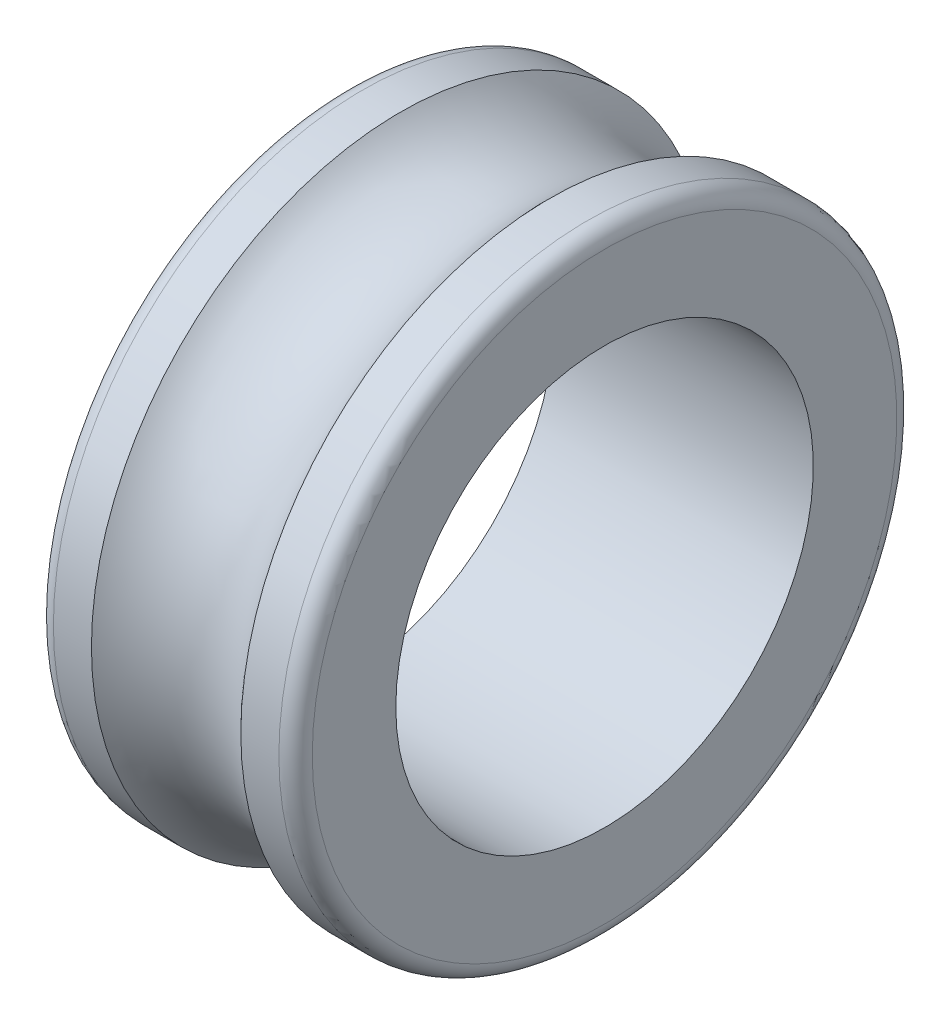
from build123d import *


with BuildPart() as part:
    # Sketch1 → Revolve1 (revolve)
    with BuildSketch(Plane.XY, mode=Mode.PRIVATE) as revolve1_sk:
        with BuildLine():
            Line((8.94427191, 37), (13.5, 37))
            ThreePointArc((13.5, 37), (14.914213562, 36.414213562), (15.5, 35))
            Line((15.5, 35), (15.5, 25))
            Line((15.5, 25), (-15.5, 25))
            Line((-15.5, 25), (-15.5, 35))
            ThreePointArc((-15.5, 35), (-14.914213562, 36.414213562), (-13.5, 37))
            Line((-13.5, 37), (-8.94427191, 37))
            ThreePointArc((-8.94427191, 37), (0, 33), (8.94427191, 37))
        make_face()
    revolve(revolve1_sk.sketch.rotate(Axis((0, 0, 0), (1, 0, 0)), 90), axis=Axis((0, 0, 0), (1, 0, 0)))


solid = part.part
